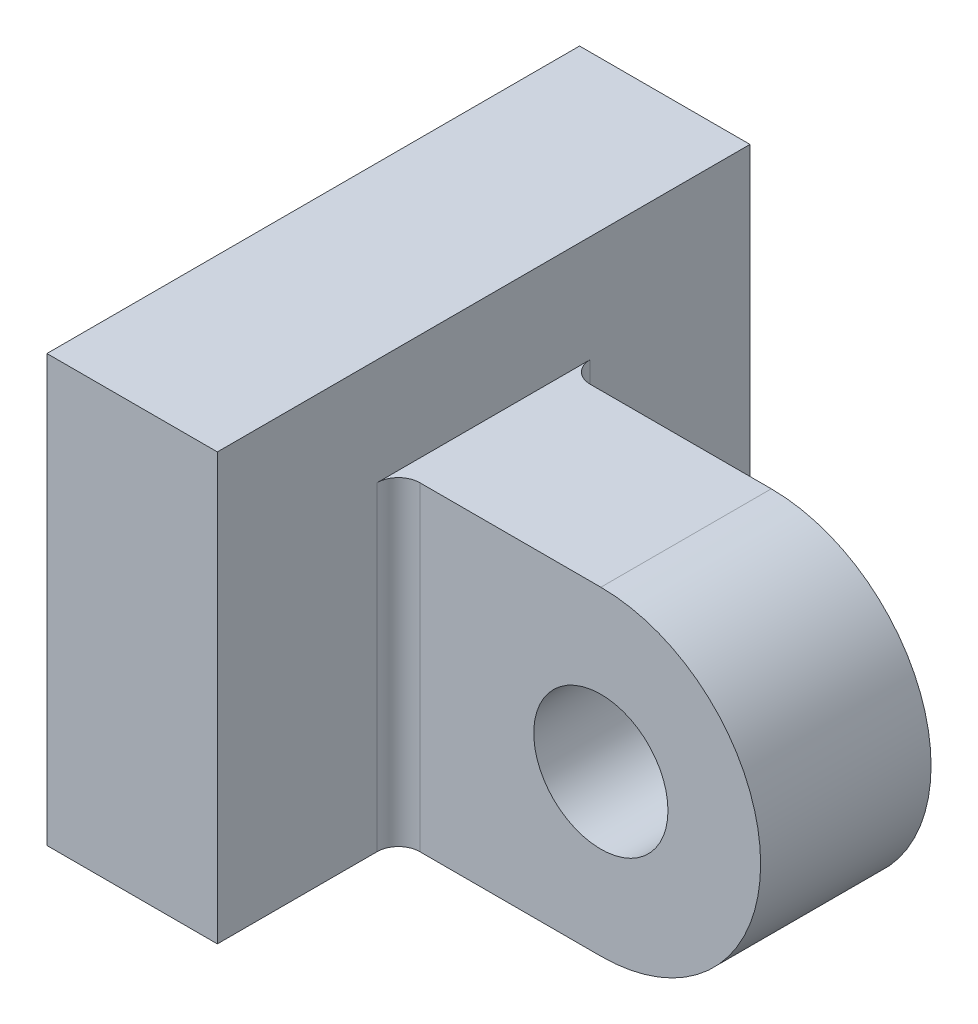
from build123d import *

# Parameters (mm, degrees)
SKETCH2_R           = 3.15
BOSS_EXTRUDE1_DEPTH = 8
SKETCH3_W           = 25
SKETCH3_H           = 20
BOSS_EXTRUDE2_DEPTH = 8
FILLET1_R           = 1


with BuildPart() as part:
    # Sketch2 → Boss-Extrude1 (new body)
    with BuildSketch(Plane.XY):
        with BuildLine():
            Line((22.912878475, -2.887716477), (5.412878475, -2.887716477))
            Line((5.412878475, -2.887716477), (5.412878475, -17.887716477))
            Line((5.412878475, -17.887716477), (22.912878475, -17.887716477))
            ThreePointArc((22.912878475, -17.887716477), (30.412878475, -10.387716477), (22.912878475, -2.887716477))
        make_face()
        with Locations((22.912878475, -10.387716477)):
            Circle(SKETCH2_R, mode=Mode.SUBTRACT)
    extrude(amount=BOSS_EXTRUDE1_DEPTH)

    # Sketch3 → Boss-Extrude2 (add)
    with BuildSketch(Plane.ZY.offset(-5.412878475)):
        with Locations((4, -7.887716477)):
            Rectangle(SKETCH3_W, SKETCH3_H)
    extrude(amount=-BOSS_EXTRUDE2_DEPTH)

    # Fillet1
    fillet1_edges = [part.edges().sort_by_distance(p)[0] for p in [
        (13.412878475, -10.387716477, 8),
        (13.412878475, -10.387716477, 0),
    ]]
    fillet(fillet1_edges, radius=FILLET1_R)


solid = part.part
